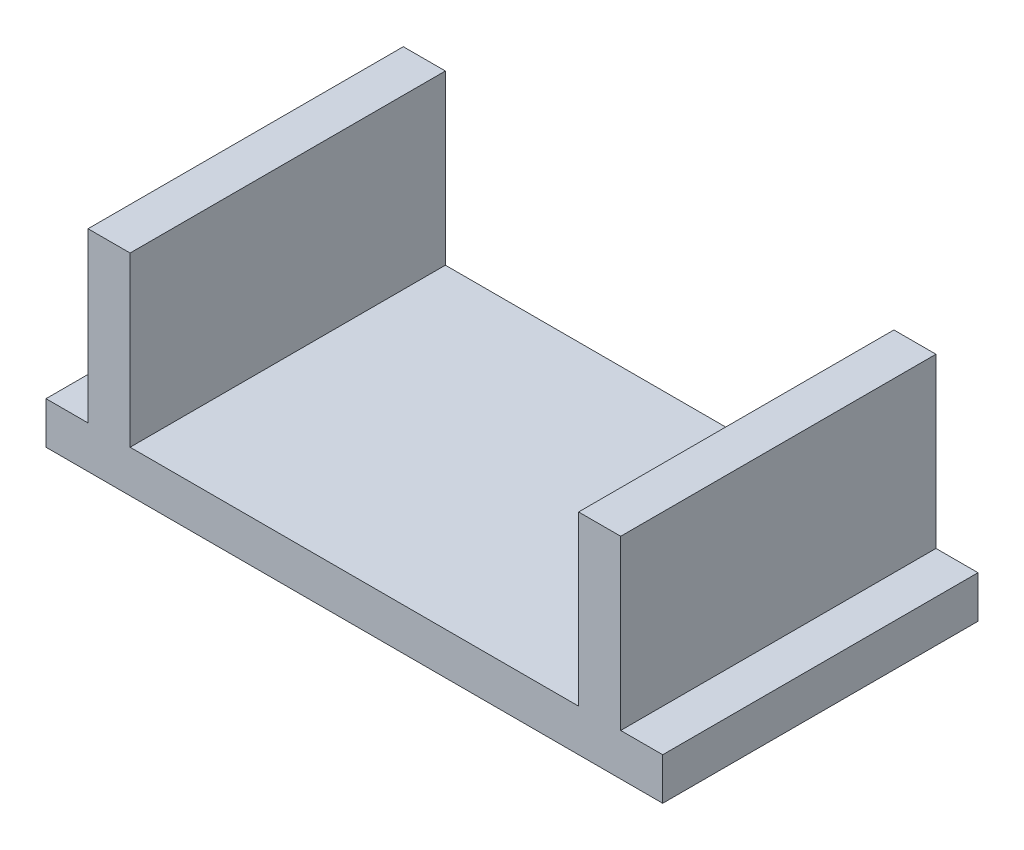
from build123d import *

# Parameters (mm, degrees)
SKETCH1_W    = 139.7
SKETCH1_H    = 9.53
BLOCK1_DEPTH = 71.42
SKETCH2_W    = 9.53
SKETCH2_H    = 38.1
BLOCK2_DEPTH = 71.42
SKETCH3_W    = 9.53
SKETCH3_H    = 38.1
BLOCK3_DEPTH = 71.42


with BuildPart() as part:
    # Sketch1 → Block1 (new body)
    with BuildSketch(Plane.XY.offset(-35.71)):
        with Locations((0, 4.765)):
            Rectangle(SKETCH1_W, SKETCH1_H)
    extrude(amount=BLOCK1_DEPTH)

    # Sketch2 → Block2 (add)
    with BuildSketch(Plane.XY.offset(-35.71)):
        with Locations((-55.565, 28.58)):
            Rectangle(SKETCH2_W, SKETCH2_H)
    extrude(amount=BLOCK2_DEPTH)

    # Sketch3 → Block3 (add)
    with BuildSketch(Plane.XY.offset(-35.71)):
        with Locations((55.565, 28.58)):
            Rectangle(SKETCH3_W, SKETCH3_H)
    extrude(amount=BLOCK3_DEPTH)


solid = part.part
